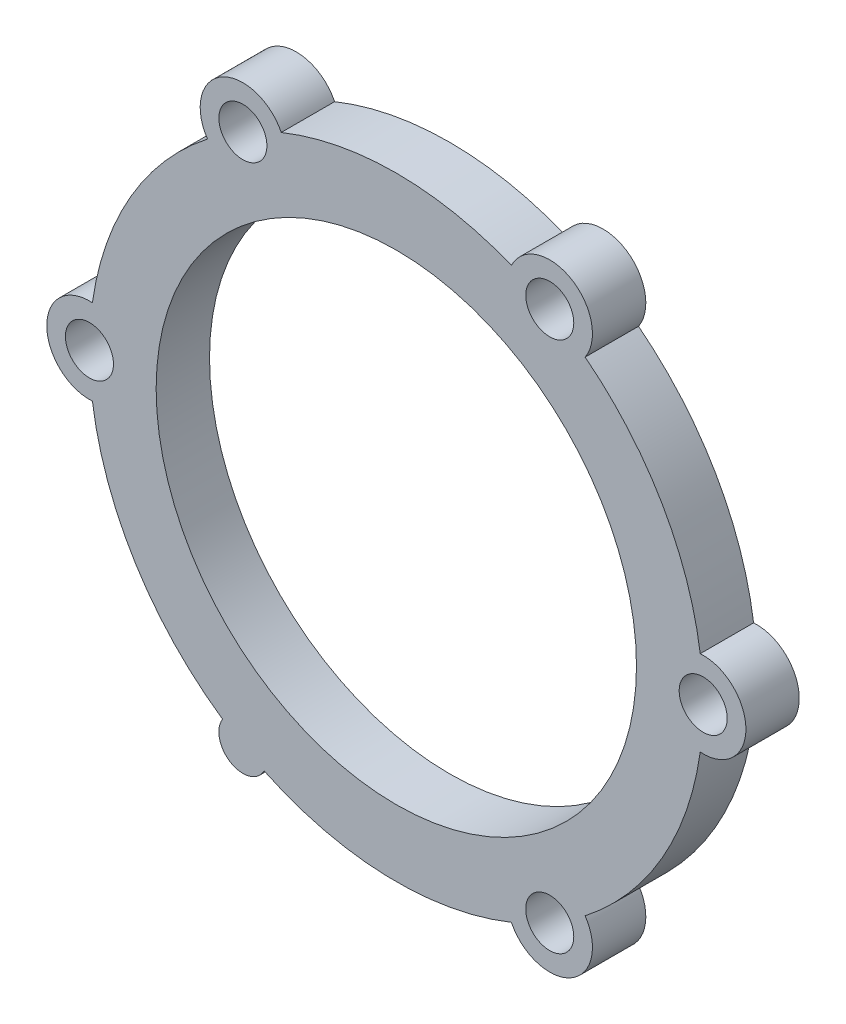
from build123d import *

# Parameters (mm, degrees)
SKETCH1_R           = 4.5
SKETCH1_R_2         = 45
BOSS_EXTRUDE1_DEPTH = 10


with BuildPart() as part:
    # Sketch1 → Boss-Extrude1 (new body)
    with BuildSketch(Plane.XY):
        with BuildLine():
            ThreePointArc((56.943478261, -7.980619246), (65.5, 0), (56.943478261, 7.980619246))
            ThreePointArc((56.943478261, 7.980619246), (49.796460718, 28.75), (35.383158136, 45.324189131))
            ThreePointArc((35.383158136, 45.324189131), (32.75, 56.724663948), (21.560320125, 53.304808377))
            ThreePointArc((21.560320125, 53.304808377), (0, 57.5), (-21.560320125, 53.304808377))
            ThreePointArc((-21.560320125, 53.304808377), (-32.75, 56.724663948), (-35.383158136, 45.324189131))
            ThreePointArc((-35.383158136, 45.324189131), (-49.796460718, 28.75), (-56.943478261, 7.980619246))
            ThreePointArc((-56.943478261, 7.980619246), (-65.5, 0), (-56.943478261, -7.980619246))
            ThreePointArc((-56.943478261, -7.980619246), (-48.897136106, -30.254257231), (-32.556086083, -47.39568819))
            ThreePointArc((-32.556086083, -47.39568819), (-31, -53.693575035), (-24.767826961, -51.89224169))
            ThreePointArc((-24.767826961, -51.89224169), (-1.752387282, -57.473290656), (21.560320125, -53.304808377))
            ThreePointArc((21.560320125, -53.304808377), (32.75, -56.724663948), (35.383158136, -45.324189131))
            ThreePointArc((35.383158136, -45.324189131), (49.796460718, -28.75), (56.943478261, -7.980619246))
        make_face()
        with Locations((57.5, 0)):
            Circle(SKETCH1_R, mode=Mode.SUBTRACT)
        with Locations((-57.5, 0)):
            Circle(SKETCH1_R, mode=Mode.SUBTRACT)
        with Locations((-28.75, 49.796460718)):
            Circle(SKETCH1_R, mode=Mode.SUBTRACT)
        with Locations((28.75, 49.796460718)):
            Circle(SKETCH1_R, mode=Mode.SUBTRACT)
        Circle(SKETCH1_R_2, mode=Mode.SUBTRACT)
        with Locations((28.75, -49.796460718)):
            Circle(SKETCH1_R, mode=Mode.SUBTRACT)
    extrude(amount=BOSS_EXTRUDE1_DEPTH)


solid = part.part
